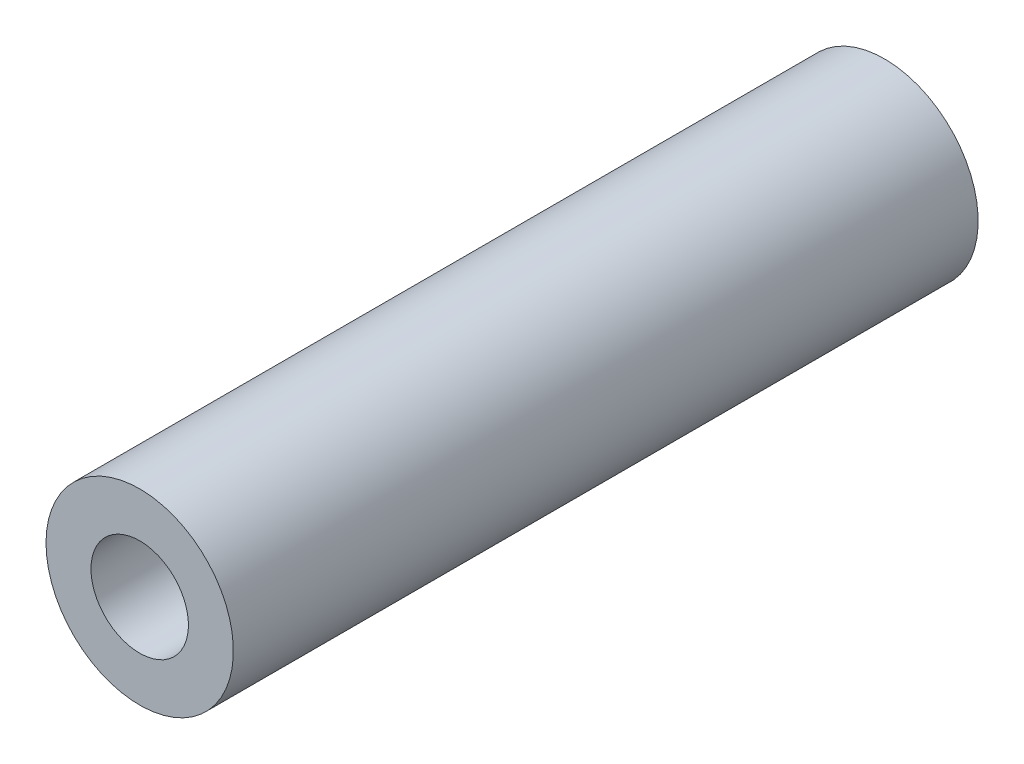
from build123d import *

# Parameters (mm, degrees)
SKETCH_1_R      = 5
SKETCH_1_R_2    = 2.6
EXTRUDE_1_DEPTH = 39.75


with BuildPart() as part:
    # 草图1 → 凸台-拉伸1 (new body)
    with BuildSketch(Plane.XY):
        with Locations(Location((0, 0, 0), (0, 0, 180))):
            Circle(SKETCH_1_R)
        with Locations(Location((0, 0, 0), (0, 0, 180))):
            Circle(SKETCH_1_R_2, mode=Mode.SUBTRACT)
    extrude(amount=EXTRUDE_1_DEPTH)


solid = part.part
